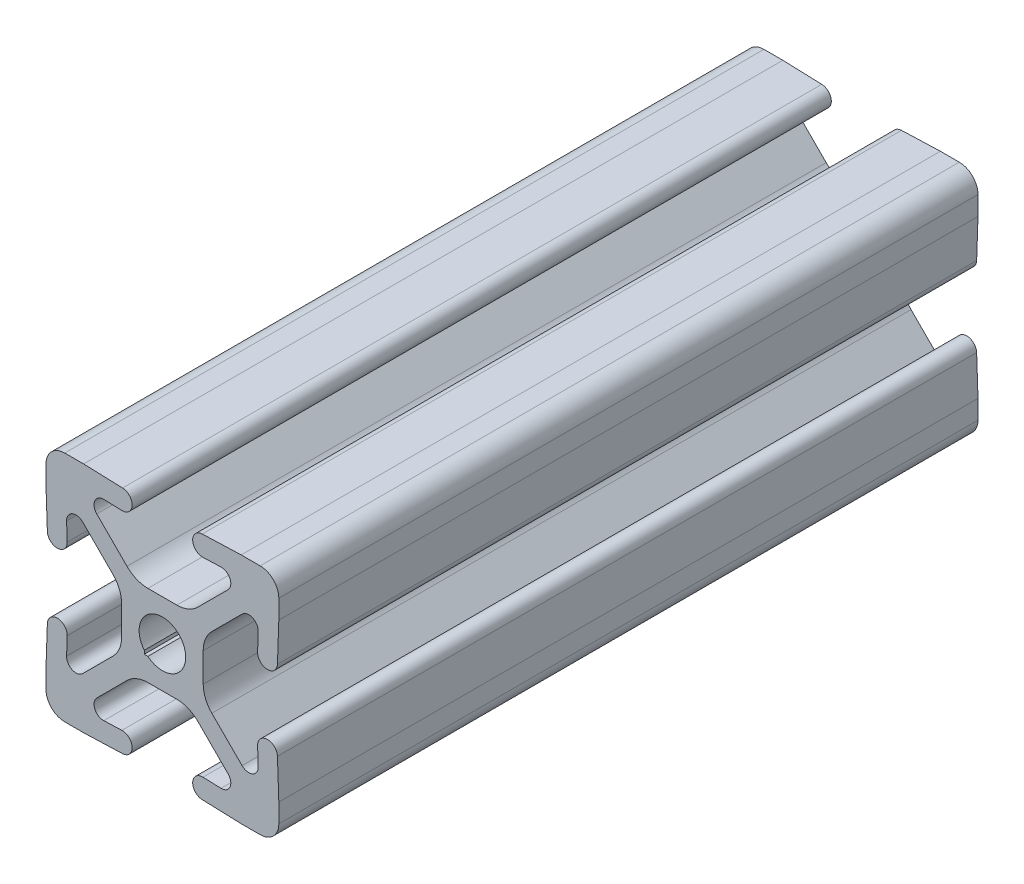
from build123d import *

# Parameters (mm, degrees)
BOSS_EXTRUDE1_DEPTH = 75.0824


with BuildPart() as part:
    # Model → Boss-Extrude1 (new body)
    with BuildSketch(Plane.XY):
        with BuildLine():
            Line((50.659960212, 72.999871414), (53.774553856, 72.999871414))
            ThreePointArc((53.774553856, 72.999871414), (54.989573754, 72.758188929), (56.019617887, 72.069935444))
            Line((56.019617887, 72.069935444), (59.264200891, 68.825352439))
            ThreePointArc((59.264200891, 68.825352439), (59.477513437, 67.701802895), (58.510322513, 67.091550869))
            Line((58.510322513, 67.091550869), (56.572487817, 67.159221548))
            ThreePointArc((56.572487817, 67.159221548), (55.4691069, 66.130302197), (56.498026251, 65.026921279))
            Line((56.498026251, 65.026921279), (60.677257034, 64.880979325))
            Line((60.677257034, 64.880979325), (62.710657034, 64.880979325))
            ThreePointArc((62.710657034, 64.880979325), (64.129537501, 65.468698857), (64.717257034, 66.887579325))
            Line((64.717257034, 66.887579325), (64.717257034, 68.920979325))
            Line((64.717257034, 68.920979325), (64.57131508, 73.100210108))
            ThreePointArc((64.57131508, 73.100210108), (63.467934162, 74.129129459), (62.439014811, 73.025748542))
            Line((62.439014811, 73.025748542), (62.50668549, 71.087913846))
            ThreePointArc((62.50668549, 71.087913846), (61.896433464, 70.120722922), (60.77288392, 70.334035468))
            Line((60.77288392, 70.334035468), (57.528300915, 73.578618472))
            ThreePointArc((57.528300915, 73.578618472), (56.84004743, 74.608662605), (56.598364945, 75.823682503))
            Line((56.598364945, 75.823682503), (56.598364945, 78.938276147))
            ThreePointArc((56.598364945, 78.938276147), (56.84004743, 80.153296044), (57.528300915, 81.183340177))
            Line((57.528300915, 81.183340177), (60.77288392, 84.427923182))
            ThreePointArc((60.77288392, 84.427923182), (61.896433464, 84.641235728), (62.50668549, 83.674044803))
            Line((62.50668549, 83.674044803), (62.439014811, 81.736210108))
            ThreePointArc((62.439014811, 81.736210108), (63.467934162, 80.63282919), (64.57131508, 81.661748542))
            Line((64.57131508, 81.661748542), (64.717257034, 85.840979325))
            Line((64.717257034, 85.840979325), (64.717257034, 87.874379325))
            ThreePointArc((64.717257034, 87.874379325), (64.129537501, 89.293259792), (62.710657034, 89.880979325))
            Line((62.710657034, 89.880979325), (60.677257034, 89.880979325))
            Line((60.677257034, 89.880979325), (56.498026251, 89.73503737))
            ThreePointArc((56.498026251, 89.73503737), (55.4691069, 88.631656452), (56.572487817, 87.602737101))
            Line((56.572487817, 87.602737101), (58.510322513, 87.67040778))
            ThreePointArc((58.510322513, 87.67040778), (59.477513437, 87.060155754), (59.264200891, 85.93660621))
            Line((59.264200891, 85.93660621), (56.019617887, 82.692023205))
            ThreePointArc((56.019617887, 82.692023205), (54.989573754, 82.00376972), (53.774553856, 81.762087236))
            Line((53.774553856, 81.762087236), (50.659960212, 81.762087236))
            ThreePointArc((50.659960212, 81.762087236), (49.444940315, 82.00376972), (48.414896182, 82.692023205))
            Line((48.414896182, 82.692023205), (45.170313177, 85.93660621))
            ThreePointArc((45.170313177, 85.93660621), (44.957000631, 87.060155754), (45.924191556, 87.67040778))
            Line((45.924191556, 87.67040778), (47.862026251, 87.602737101))
            ThreePointArc((47.862026251, 87.602737101), (48.965407169, 88.631656452), (47.936487817, 89.73503737))
            Line((47.936487817, 89.73503737), (43.757257034, 89.880979325))
            Line((43.757257034, 89.880979325), (41.723857034, 89.880979325))
            ThreePointArc((41.723857034, 89.880979325), (40.304976567, 89.293259792), (39.717257034, 87.874379325))
            Line((39.717257034, 87.874379325), (39.717257034, 85.840979325))
            Line((39.717257034, 85.840979325), (39.863198989, 81.661748542))
            ThreePointArc((39.863198989, 81.661748542), (40.966579907, 80.63282919), (41.995499258, 81.736210108))
            Line((41.995499258, 81.736210108), (41.927828579, 83.674044803))
            ThreePointArc((41.927828579, 83.674044803), (42.538080605, 84.641235728), (43.661630149, 84.427923182))
            Line((43.661630149, 84.427923182), (46.906213154, 81.183340177))
            ThreePointArc((46.906213154, 81.183340177), (47.594466639, 80.153296044), (47.836149123, 78.938276147))
            Line((47.836149123, 78.938276147), (47.836149123, 75.823682503))
            ThreePointArc((47.836149123, 75.823682503), (47.594466639, 74.608662605), (46.906213154, 73.578618472))
            Line((46.906213154, 73.578618472), (43.661630149, 70.334035468))
            ThreePointArc((43.661630149, 70.334035468), (42.538080605, 70.120722922), (41.927828579, 71.087913846))
            Line((41.927828579, 71.087913846), (41.995499258, 73.025748542))
            ThreePointArc((41.995499258, 73.025748542), (40.966579907, 74.129129459), (39.863198989, 73.100210108))
            Line((39.863198989, 73.100210108), (39.717257034, 68.920979325))
            Line((39.717257034, 68.920979325), (39.717257034, 66.887579325))
            ThreePointArc((39.717257034, 66.887579325), (40.304976567, 65.468698857), (41.723857034, 64.880979325))
            Line((41.723857034, 64.880979325), (43.757257034, 64.880979325))
            Line((43.757257034, 64.880979325), (47.936487817, 65.026921279))
            ThreePointArc((47.936487817, 65.026921279), (48.965407169, 66.130302197), (47.862026251, 67.159221548))
            Line((47.862026251, 67.159221548), (45.924191556, 67.091550869))
            ThreePointArc((45.924191556, 67.091550869), (44.957000631, 67.701802895), (45.170313177, 68.825352439))
            Line((45.170313177, 68.825352439), (48.414896182, 72.069935444))
            ThreePointArc((48.414896182, 72.069935444), (49.444940315, 72.758188929), (50.659960212, 72.999871414))
        make_face()
        with BuildLine():
            Line((50.64953831, 75.433607249), (50.269884959, 75.433607249))
            Line((50.269884959, 75.433607249), (50.269884959, 75.8132606))
            ThreePointArc((50.269884959, 75.8132606), (53.985023987, 79.148746278), (50.64953831, 75.433607249))
        make_face(mode=Mode.SUBTRACT)
    extrude(amount=BOSS_EXTRUDE1_DEPTH)


solid = part.part
